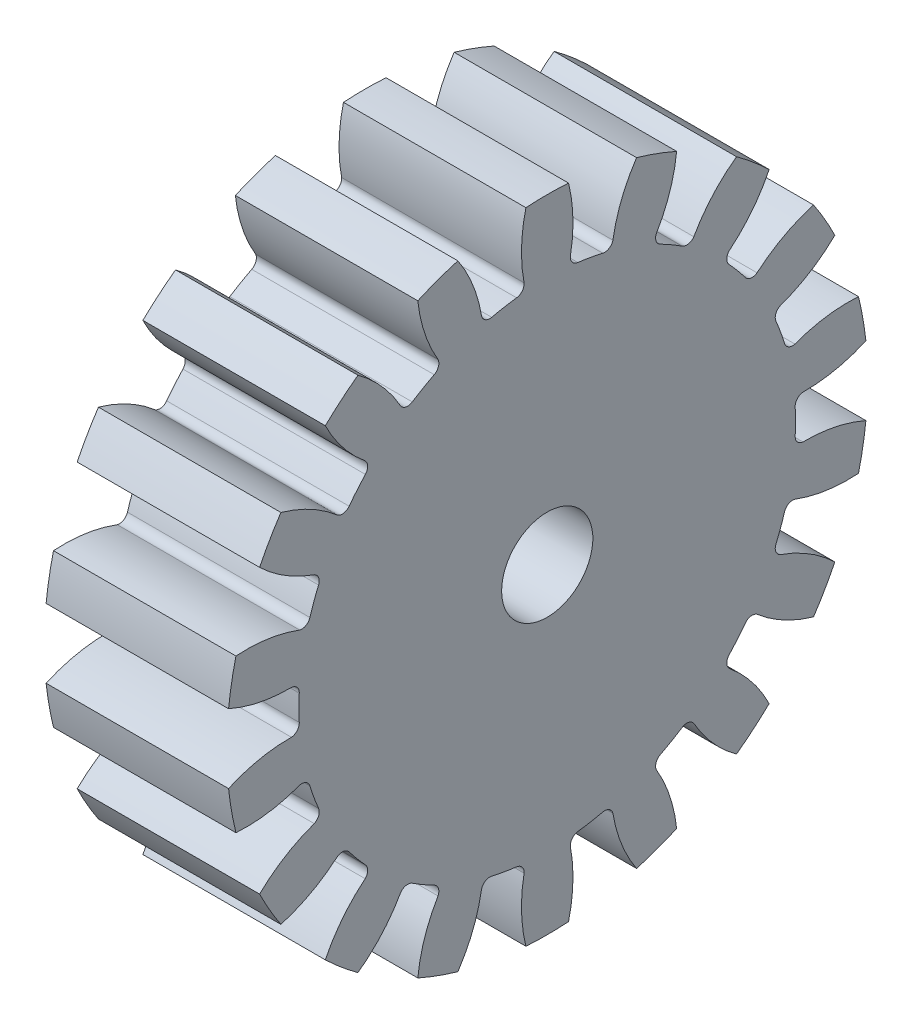
from build123d import *

# Parameters (mm, degrees)
SKETCH1_R           = 1.5
BOSS_EXTRUDE1_DEPTH = 6


with BuildPart() as part:
    # Sketch1 → Boss-Extrude1 (new body)
    with BuildSketch(Plane(origin=(-5.0626, 0, 0), x_dir=(0, -1, 0), z_dir=(-1, 0, 0))):
        with BuildLine():
            ThreePointArc((-4.922723194, -6.514140109), (-4.81466795, -6.694813212), (-4.862727039, -6.899774256))
            ThreePointArc((-4.862727039, -6.899774256), (-5.464359209, -7.774942381), (-5.865718199, -8.758197931))
            ThreePointArc((-5.865718199, -8.758197931), (-5.2705, -9.128773781), (-4.6519628, -9.458959938))
            ThreePointArc((-4.6519628, -9.458959938), (-4.000662594, -8.620025741), (-3.544016267, -7.661132275))
            ThreePointArc((-3.544016267, -7.661132275), (-3.39054434, -7.517031361), (-3.180049221, -7.520273396))
            ThreePointArc((-3.180049221, -7.520273396), (-2.79259447, -7.672590249), (-2.397879526, -7.804959883))
            ThreePointArc((-2.397879526, -7.804959883), (-2.23454697, -7.937779995), (-2.209606935, -8.146817552))
            ThreePointArc((-2.209606935, -8.146817552), (-2.475631119, -9.174976903), (-2.516491996, -10.236207747))
            ThreePointArc((-2.516491996, -10.236207747), (-1.830425441, -10.380858525), (-1.136260282, -10.479579838))
            ThreePointArc((-1.136260282, -10.479579838), (-0.811170678, -9.468481773), (-0.710024375, -8.411234417))
            ThreePointArc((-0.710024375, -8.411234417), (-0.615093353, -8.223333361), (-0.416183802, -8.154386307))
            ThreePointArc((-0.416183802, -8.154386307), (0, -8.165), (0.416183802, -8.154386307))
            ThreePointArc((0.416183802, -8.154386307), (0.615093353, -8.223333361), (0.710024375, -8.411234417))
            ThreePointArc((0.710024375, -8.411234417), (0.811694621, -9.468373801), (1.136260282, -10.479579838))
            ThreePointArc((1.136260282, -10.479579838), (1.830425441, -10.380858525), (2.516491996, -10.236207747))
            ThreePointArc((2.516491996, -10.236207747), (2.476160393, -9.174899164), (2.209606935, -8.146817552))
            ThreePointArc((2.209606935, -8.146817552), (2.23454697, -7.937779995), (2.397879526, -7.804959883))
            ThreePointArc((2.397879526, -7.804959883), (2.79259447, -7.672590249), (3.180049221, -7.520273396))
            ThreePointArc((3.180049221, -7.520273396), (3.39054434, -7.517031361), (3.544016267, -7.661132275))
            ThreePointArc((3.544016267, -7.661132275), (4.001118011, -8.619745081), (4.6519628, -9.458959938))
            ThreePointArc((4.6519628, -9.458959938), (5.2705, -9.128773781), (5.865718199, -8.758197931))
            ThreePointArc((5.865718199, -8.758197931), (5.464829976, -7.774688308), (4.862727039, -6.899774256))
            ThreePointArc((4.862727039, -6.899774256), (4.81466795, -6.694813212), (4.922723194, -6.514140109))
            ThreePointArc((4.922723194, -6.514140109), (5.248360833, -6.254752878), (5.560353772, -5.979104526))
            ThreePointArc((5.560353772, -5.979104526), (5.75704564, -5.904064439), (5.950547493, -5.986984514))
            ThreePointArc((5.950547493, -5.986984514), (6.707947518, -6.73144789), (7.606569949, -7.29744987))
            ThreePointArc((7.606569949, -7.29744987), (8.074874475, -6.775624194), (8.507452219, -6.223820188))
            ThreePointArc((8.507452219, -6.223820188), (7.794360412, -5.436735301), (6.929330495, -4.820516355))
            ThreePointArc((6.929330495, -4.820516355), (6.814068918, -4.64435315), (6.853813793, -4.437618899))
            ThreePointArc((6.853813793, -4.437618899), (7.071097422, -4.0825), (7.269997595, -3.716767408))
            ThreePointArc((7.269997595, -3.716767408), (7.429162271, -3.578980211), (7.63935487, -3.590718063))
            ThreePointArc((7.63935487, -3.590718063), (8.605699555, -4.031238738), (9.643712501, -4.255759649))
            ThreePointArc((9.643712501, -4.255759649), (9.905299916, -3.605234331), (10.123061945, -2.938757877))
            ThreePointArc((10.123061945, -2.938757877), (9.18377595, -2.443031778), (8.160154428, -2.159833038))
            ThreePointArc((8.160154428, -2.159833038), (7.99159261, -2.033715556), (7.958233297, -1.825855357))
            ThreePointArc((7.958233297, -1.825855357), (8.040955303, -1.417837371), (8.102772415, -1.006133287))
            ThreePointArc((8.102772415, -1.006133287), (8.20521229, -0.82221815), (8.406743306, -0.761358019))
            ThreePointArc((8.406743306, -0.761358019), (9.46547722, -0.8448027), (10.517681, -0.700762007))
            ThreePointArc((10.517681, -0.700762007), (10.541, 0), (10.517681, 0.700762007))
            ThreePointArc((10.517681, 0.700762007), (9.46549257, 0.845337432), (8.406743306, 0.761358019))
            ThreePointArc((8.406743306, 0.761358019), (8.20521229, 0.82221815), (8.102772415, 1.006133287))
            ThreePointArc((8.102772415, 1.006133287), (8.040955303, 1.417837371), (7.958233297, 1.825855357))
            ThreePointArc((7.958233297, 1.825855357), (7.99159261, 2.033715556), (8.160154428, 2.159833038))
            ThreePointArc((8.160154428, 2.159833038), (9.183578636, 2.443529012), (10.123061945, 2.938757877))
            ThreePointArc((10.123061945, 2.938757877), (9.905299916, 3.605234331), (9.643712501, 4.255759649))
            ThreePointArc((9.643712501, 4.255759649), (8.60553109, 4.031746473), (7.63935487, 3.590718063))
            ThreePointArc((7.63935487, 3.590718063), (7.429162271, 3.578980211), (7.269997595, 3.716767408))
            ThreePointArc((7.269997595, 3.716767408), (7.071097422, 4.0825), (6.853813793, 4.437618899))
            ThreePointArc((6.853813793, 4.437618899), (6.814068918, 4.64435315), (6.929330495, 4.820516355))
            ThreePointArc((6.929330495, 4.820516355), (7.794004934, 5.437135063), (8.507452219, 6.223820188))
            ThreePointArc((8.507452219, 6.223820188), (8.074874475, 6.775624194), (7.606569949, 7.29744987))
            ThreePointArc((7.606569949, 7.29744987), (6.707615557, 6.731867386), (5.950547493, 5.986984514))
            ThreePointArc((5.950547493, 5.986984514), (5.75704564, 5.904064439), (5.560353772, 5.979104526))
            ThreePointArc((5.560353772, 5.979104526), (5.248360833, 6.254752878), (4.922723194, 6.514140109))
            ThreePointArc((4.922723194, 6.514140109), (4.81466795, 6.694813212), (4.862727039, 6.899774256))
            ThreePointArc((4.862727039, 6.899774256), (5.464359209, 7.774942381), (5.865718199, 8.758197931))
            ThreePointArc((5.865718199, 8.758197931), (5.2705, 9.128773781), (4.6519628, 9.458959938))
            ThreePointArc((4.6519628, 9.458959938), (4.000662594, 8.620025741), (3.544016267, 7.661132275))
            ThreePointArc((3.544016267, 7.661132275), (3.39054434, 7.517031361), (3.180049221, 7.520273396))
            ThreePointArc((3.180049221, 7.520273396), (2.79259447, 7.672590249), (2.397879526, 7.804959883))
            ThreePointArc((2.397879526, 7.804959883), (2.23454697, 7.937779995), (2.209606935, 8.146817552))
            ThreePointArc((2.209606935, 8.146817552), (2.475631119, 9.174976903), (2.516491996, 10.236207747))
            ThreePointArc((2.516491996, 10.236207747), (1.830425441, 10.380858525), (1.136260282, 10.479579838))
            ThreePointArc((1.136260282, 10.479579838), (0.811170678, 9.468481773), (0.710024375, 8.411234417))
            ThreePointArc((0.710024375, 8.411234417), (0.615093353, 8.223333361), (0.416183802, 8.154386307))
            ThreePointArc((0.416183802, 8.154386307), (0, 8.165), (-0.416183802, 8.154386307))
            ThreePointArc((-0.416183802, 8.154386307), (-0.615093353, 8.223333361), (-0.710024375, 8.411234417))
            ThreePointArc((-0.710024375, 8.411234417), (-0.811694621, 9.468373801), (-1.136260282, 10.479579838))
            ThreePointArc((-1.136260282, 10.479579838), (-1.830425441, 10.380858525), (-2.516491996, 10.236207747))
            ThreePointArc((-2.516491996, 10.236207747), (-2.476020242, 9.170776838), (-2.207579692, 8.138923817))
            ThreePointArc((-2.207579692, 8.138923817), (-2.236538702, 7.934224847), (-2.397879526, 7.804959883))
            ThreePointArc((-2.397879526, 7.804959883), (-2.79259447, 7.672590249), (-3.180049221, 7.520273396))
            ThreePointArc((-3.180049221, 7.520273396), (-3.39054434, 7.517031361), (-3.544016267, 7.661132275))
            ThreePointArc((-3.544016267, 7.661132275), (-4.001118011, 8.619745081), (-4.6519628, 9.458959938))
            ThreePointArc((-4.6519628, 9.458959938), (-5.2705, 9.128773781), (-5.865718199, 8.758197931))
            ThreePointArc((-5.865718199, 8.758197931), (-5.464829976, 7.774688308), (-4.862727039, 6.899774256))
            ThreePointArc((-4.862727039, 6.899774256), (-4.81466795, 6.694813212), (-4.922723194, 6.514140109))
            ThreePointArc((-4.922723194, 6.514140109), (-5.248360833, 6.254752878), (-5.560353772, 5.979104526))
            ThreePointArc((-5.560353772, 5.979104526), (-5.75704564, 5.904064439), (-5.950547493, 5.986984514))
            ThreePointArc((-5.950547493, 5.986984514), (-6.707947518, 6.73144789), (-7.606569949, 7.29744987))
            ThreePointArc((-7.606569949, 7.29744987), (-8.074874475, 6.775624194), (-8.507452219, 6.223820188))
            ThreePointArc((-8.507452219, 6.223820188), (-7.794360412, 5.436735301), (-6.929330495, 4.820516355))
            ThreePointArc((-6.929330495, 4.820516355), (-6.814068918, 4.64435315), (-6.853813793, 4.437618899))
            ThreePointArc((-6.853813793, 4.437618899), (-7.071097422, 4.0825), (-7.269997595, 3.716767408))
            ThreePointArc((-7.269997595, 3.716767408), (-7.429162271, 3.578980211), (-7.63935487, 3.590718063))
            ThreePointArc((-7.63935487, 3.590718063), (-8.605699555, 4.031238738), (-9.643712501, 4.255759649))
            ThreePointArc((-9.643712501, 4.255759649), (-9.905299916, 3.605234331), (-10.123061945, 2.938757877))
            ThreePointArc((-10.123061945, 2.938757877), (-9.18377595, 2.443031778), (-8.160154428, 2.159833038))
            ThreePointArc((-8.160154428, 2.159833038), (-7.99159261, 2.033715556), (-7.958233297, 1.825855357))
            ThreePointArc((-7.958233297, 1.825855357), (-8.040955303, 1.417837371), (-8.102772415, 1.006133287))
            ThreePointArc((-8.102772415, 1.006133287), (-8.20521229, 0.82221815), (-8.406743306, 0.761358019))
            ThreePointArc((-8.406743306, 0.761358019), (-9.46547722, 0.8448027), (-10.517681, 0.700762007))
            ThreePointArc((-10.517681, 0.700762007), (-10.541, 0), (-10.517681, -0.700762007))
            ThreePointArc((-10.517681, -0.700762007), (-9.46549257, -0.845337432), (-8.406743306, -0.761358019))
            ThreePointArc((-8.406743306, -0.761358019), (-8.20521229, -0.82221815), (-8.102772415, -1.006133287))
            ThreePointArc((-8.102772415, -1.006133287), (-8.040955303, -1.417837371), (-7.958233297, -1.825855357))
            ThreePointArc((-7.958233297, -1.825855357), (-7.99159261, -2.033715556), (-8.160154428, -2.159833038))
            ThreePointArc((-8.160154428, -2.159833038), (-9.183578636, -2.443529012), (-10.123061945, -2.938757877))
            ThreePointArc((-10.123061945, -2.938757877), (-9.905299916, -3.605234331), (-9.643712501, -4.255759649))
            ThreePointArc((-9.643712501, -4.255759649), (-8.60553109, -4.031746473), (-7.63935487, -3.590718063))
            ThreePointArc((-7.63935487, -3.590718063), (-7.429162271, -3.578980211), (-7.269997595, -3.716767408))
            ThreePointArc((-7.269997595, -3.716767408), (-7.071097422, -4.0825), (-6.853813793, -4.437618899))
            ThreePointArc((-6.853813793, -4.437618899), (-6.814068918, -4.64435315), (-6.929330495, -4.820516355))
            ThreePointArc((-6.929330495, -4.820516355), (-7.794004934, -5.437135063), (-8.507452219, -6.223820188))
            ThreePointArc((-8.507452219, -6.223820188), (-8.074874475, -6.775624194), (-7.606569949, -7.29744987))
            ThreePointArc((-7.606569949, -7.29744987), (-6.707615557, -6.731867386), (-5.950547493, -5.986984514))
            ThreePointArc((-5.950547493, -5.986984514), (-5.75704564, -5.904064439), (-5.560353772, -5.979104526))
            ThreePointArc((-5.560353772, -5.979104526), (-5.248360833, -6.254752878), (-4.922723194, -6.514140109))
        make_face()
        with Locations(Location((0, 0, 0), (0, 0, 90))):
            Circle(SKETCH1_R, mode=Mode.SUBTRACT)
    extrude(amount=-BOSS_EXTRUDE1_DEPTH)


solid = part.part
